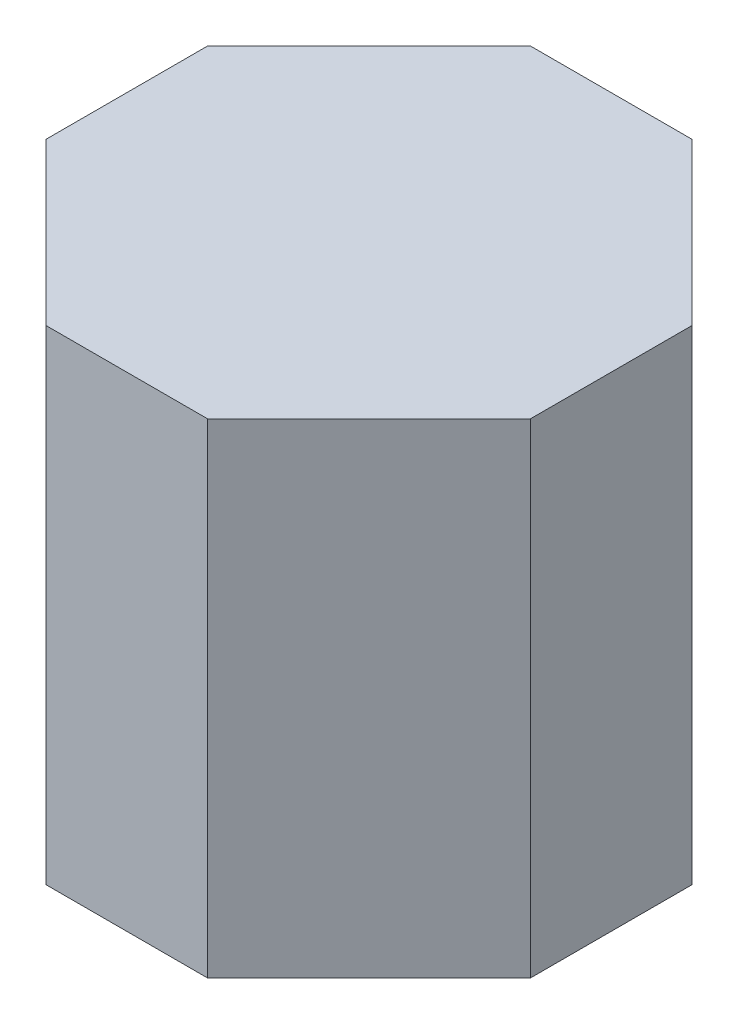
from build123d import *

# Parameters (mm, degrees)
ESQUISSE1_W             = 30
ESQUISSE1_H             = 30
BOSS_EXTRU_1_DEPTH      = 30
ENL_V_MAT_EXTRU_1_REACH = 47
ENL_V_MAT_EXTRU_2_REACH = 41.843
ESQUISSE4_R             = 3.25
ESQUISSE6_R             = 2.75
ENL_V_MAT_EXTRU_3_DEPTH = 10


with BuildPart() as part:
    # Esquisse1 → Boss.-Extru.1 (new body)
    with BuildSketch(Plane.XY):
        Rectangle(ESQUISSE1_W, ESQUISSE1_H)
    extrude(amount=BOSS_EXTRU_1_DEPTH)

    # Esquisse3 → Enlèv. mat.-Extru.1 (cut, up to next)
    with BuildSketch(Plane(origin=(0, 15, 0), x_dir=(1, 0, 0), z_dir=(0, 1, 0)), mode=Mode.PRIVATE) as enl_v_mat_extru_1_sk1:
        Polygon((-15, -20), (-5, -30), (-15, -30), align=None)
    enl_v_mat_extru_1_tool1 = extrude(enl_v_mat_extru_1_sk1.sketch, amount=-ENL_V_MAT_EXTRU_1_REACH, mode=Mode.PRIVATE) & part.part
    # Esquisse3 → Enlèv. mat.-Extru.1 (cut, up to next)
    with BuildSketch(Plane(origin=(0, 15, 0), x_dir=(1, 0, 0), z_dir=(0, 1, 0)), mode=Mode.PRIVATE) as enl_v_mat_extru_1_sk2:
        Polygon((-15, 0), (-15, -10), (-5, 0), align=None)
    enl_v_mat_extru_1_tool2 = extrude(enl_v_mat_extru_1_sk2.sketch, amount=-ENL_V_MAT_EXTRU_1_REACH, mode=Mode.PRIVATE) & part.part
    # Esquisse3 → Enlèv. mat.-Extru.1 (cut, up to next)
    with BuildSketch(Plane(origin=(0, 15, 0), x_dir=(1, 0, 0), z_dir=(0, 1, 0)), mode=Mode.PRIVATE) as enl_v_mat_extru_1_sk3:
        Polygon((15, 0), (5, 0), (15, -10), align=None)
    enl_v_mat_extru_1_tool3 = extrude(enl_v_mat_extru_1_sk3.sketch, amount=-ENL_V_MAT_EXTRU_1_REACH, mode=Mode.PRIVATE) & part.part
    # Esquisse3 → Enlèv. mat.-Extru.1 (cut, up to next)
    with BuildSketch(Plane(origin=(0, 15, 0), x_dir=(1, 0, 0), z_dir=(0, 1, 0)), mode=Mode.PRIVATE) as enl_v_mat_extru_1_sk4:
        Polygon((15, -30), (15, -20), (5, -30), align=None)
    enl_v_mat_extru_1_tool4 = extrude(enl_v_mat_extru_1_sk4.sketch, amount=-ENL_V_MAT_EXTRU_1_REACH, mode=Mode.PRIVATE) & part.part
    add(enl_v_mat_extru_1_tool1.solids().sort_by_distance((-11.666667, 15, 26.666667))[0], mode=Mode.SUBTRACT)
    add(enl_v_mat_extru_1_tool2.solids().sort_by_distance((-11.666667, 15, 3.333333))[0], mode=Mode.SUBTRACT)
    add(enl_v_mat_extru_1_tool3.solids().sort_by_distance((11.666667, 15, 3.333333))[0], mode=Mode.SUBTRACT)
    add(enl_v_mat_extru_1_tool4.solids().sort_by_distance((11.666667, 15, 26.666667))[0], mode=Mode.SUBTRACT)

    # Esquisse4 → Enlèv. mat.-Extru.2 (cut, up to next)
    with BuildSketch(Plane(origin=(-17.5, 0, 17.5), x_dir=(0.7071067811865489, 0, 0.7071067811865462), z_dir=(-0.7071067811865462, 0, 0.7071067811865489)), mode=Mode.PRIVATE) as enl_v_mat_extru_2_sk1:
        with Locations((10.605533906, -5)):
            Circle(ESQUISSE4_R)
    enl_v_mat_extru_2_tool1 = extrude(enl_v_mat_extru_2_sk1.sketch, amount=-ENL_V_MAT_EXTRU_2_REACH, mode=Mode.PRIVATE) & part.part
    add(enl_v_mat_extru_2_tool1.solids().sort_by_distance((-10.000755, -5, 24.999245))[0], mode=Mode.SUBTRACT)

    # Esquisse6 → Enlèv. mat.-Extru.3 (cut)
    with BuildSketch(Plane.XZ.offset(15)):
        with Locations(Location((0, 15, 0), (0, 0, 270))):
            Circle(ESQUISSE6_R)
    extrude(amount=-ENL_V_MAT_EXTRU_3_DEPTH, mode=Mode.SUBTRACT)


solid = part.part
